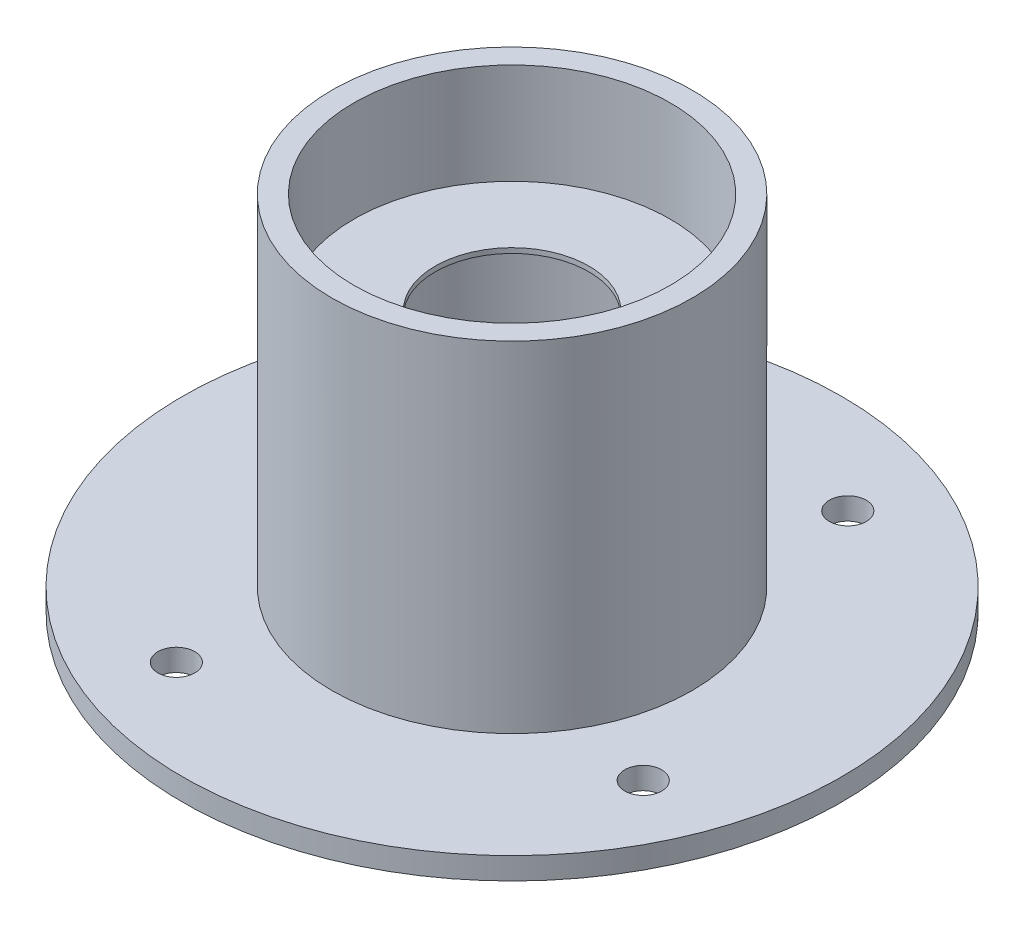
from build123d import *

# Parameters (mm, degrees)
BOSS_EXTRU_1_START           = 3.85
ESQUISSE2_R                  = 41
ESQUISSE2_R_2                = 36
BOSS_EXTRU_1_DEPTH           = 3.85
ENL_V_START                  = -26.5
ESQUISSE4_R                  = 41
ESQUISSE4_R_2                = 36
ENL_V_MAT_EXTRU_2_DEPTH      = 26.5
BOSS_EXTRU_2_START           = 5
ESQUISSE5_R                  = 75
ESQUISSE5_R_2                = 36
BOSS_EXTRU_2_DEPTH           = 5
D_GAGEMENT_M81_D             = 8.4
R_P_TITION_CIRCULAIRE1_COUNT = 4


with BuildPart() as part:
    # Esquisse1 → Révolution1 (revolve)
    with BuildSketch(Plane.XY, mode=Mode.PRIVATE) as r_volution1_sk:
        Polygon((-17.5, 0.57), (-17.5, -0.57), (-36, -0.57), (-36, -50), (-41, -50), (-41, 50), (-36, 50), (-36, 0.57), align=None)
    revolve(r_volution1_sk.sketch.rotate(Axis((0, 7.711117165, 0), (0, -1, 0)), 270), axis=Axis((0, 7.711117165, 0), (0, -1, 0)))

    # Esquisse2 → Boss.-Extru.1 (add)
    with BuildSketch(Plane.XZ.offset(50).offset(BOSS_EXTRU_1_START)):
        with Locations(Location((0, 0, 0), (0, 0, 90))):
            Circle(ESQUISSE2_R)
        with Locations(Location((0, 0, 0), (0, 0, 90))):
            Circle(ESQUISSE2_R_2, mode=Mode.SUBTRACT)
    extrude(amount=-BOSS_EXTRU_1_DEPTH)

    # Esquisse4 → Enlèv. mat.-Extru.2 (cut)
    with BuildSketch(Plane(origin=(0, 50, 0), x_dir=(1, 0, 0), z_dir=(0, 1, 0)).offset(ENL_V_START)):
        with Locations(Location((0, 0, 0), (0, 0, 270))):
            Circle(ESQUISSE4_R)
        with Locations(Location((0, 0, 0), (0, 0, 270))):
            Circle(ESQUISSE4_R_2, mode=Mode.SUBTRACT)
    extrude(amount=ENL_V_MAT_EXTRU_2_DEPTH, mode=Mode.SUBTRACT)

    # Esquisse5 → Boss.-Extru.2 (add)
    with BuildSketch(Plane.XZ.offset(53.85).offset(BOSS_EXTRU_2_START)):
        with Locations(Location((0, 0, 0), (0, 0, 270))):
            Circle(ESQUISSE5_R)
        with Locations(Location((0, 0, 0), (0, 0, 90))):
            Circle(ESQUISSE5_R_2, mode=Mode.SUBTRACT)
    extrude(amount=-BOSS_EXTRU_2_DEPTH)

    # Dégagement M81 (through all)
    with Locations(Plane(origin=(0, -53.85, 0), x_dir=(1, 0, 0), z_dir=(0, 1, 0))):
        with Locations((53.123973782, -23.277530145)):
            d_gagement_m81 = Hole(D_GAGEMENT_M81_D / 2)

    # Répétition circulaire1: Dégagement M81 ×4 about axis
    r_p_tition_circulaire1_axis = Axis((0, 0, 0), (0, 1, 0))
    for i in range(1, R_P_TITION_CIRCULAIRE1_COUNT):
        add(d_gagement_m81.rotate(r_p_tition_circulaire1_axis, i * 360 / R_P_TITION_CIRCULAIRE1_COUNT), mode=Mode.SUBTRACT)


solid = part.part
